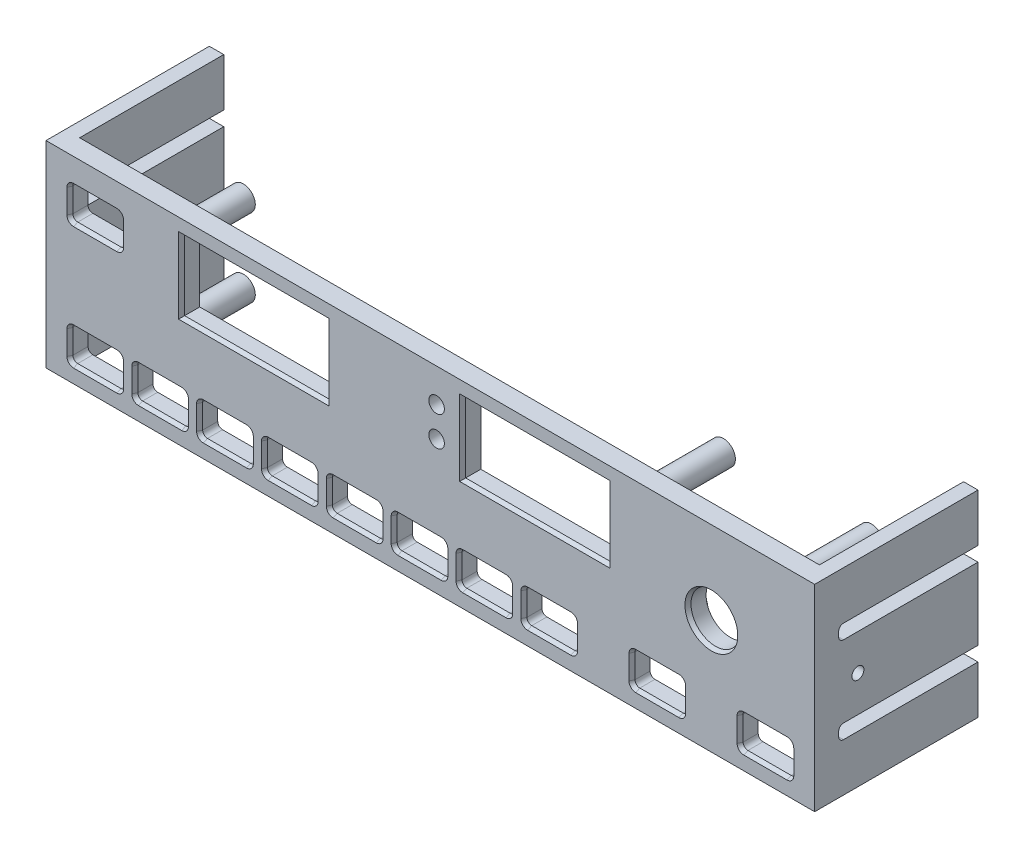
from build123d import *

# Parameters (mm, degrees)
ESQUISSE1_W             = 160
ESQUISSE1_H             = 41
BOSS_EXTRU_1_DEPTH      = 4
ESQUISSE2_R             = 5.1
ESQUISSE2_R_2           = 1.625
ESQUISSE2_W             = 30.5
ESQUISSE2_H             = 15
ENL_V_MAT_EXTRU_1_DEPTH = 4
ESQUISSE4_W             = 3
ESQUISSE4_H             = 41
BOSS_EXTRU_2_DEPTH      = 30
ENL_V_MAT_EXTRU_2_DEPTH = 168.871975029
ESQUISSE7_R             = 2.5
ESQUISSE7_R_2           = 1.25
BOSS_EXTRU_3_DEPTH      = 15
CHANFREIN1_SIZE         = 0.4
CHANFREIN1_SIZE2        = 0.857802768
ESQUISSE9_R             = 1.25
ENL_V_MAT_EXTRU_3_DEPTH = 900


with BuildPart() as part:
    # Esquisse1 → Boss.-Extru.1 (new body)
    with BuildSketch(Plane.XY):
        with Locations((80, 20.5)):
            Rectangle(ESQUISSE1_W, ESQUISSE1_H)
    extrude(amount=BOSS_EXTRU_1_DEPTH)

    # Esquisse2 → Enlèv. mat.-Extru.1 (cut)
    with BuildSketch(Plane.XY.offset(4)):
        with Locations((138.5, 23.75)):
            Circle(ESQUISSE2_R)
        with Locations((81.3, 34.05)):
            Circle(ESQUISSE2_R_2)
        with Locations((81.3, 27.83)):
            Circle(ESQUISSE2_R_2)
        with BuildLine():
            Line((19.25, 10.25), (28.25, 10.25))
            ThreePointArc((28.25, 10.25), (28.957106781, 9.957106781), (29.25, 9.25))
            Line((29.25, 9.25), (29.25, 4.25))
            ThreePointArc((29.25, 4.25), (28.957106781, 3.542893219), (28.25, 3.25))
            Line((28.25, 3.25), (19.25, 3.25))
            ThreePointArc((19.25, 3.25), (18.542893219, 3.542893219), (18.25, 4.25))
            Line((18.25, 4.25), (18.25, 9.25))
            ThreePointArc((18.25, 9.25), (18.542893219, 9.957106781), (19.25, 10.25))
        make_face()
        with BuildLine():
            Line((5.75, 3.25), (14.75, 3.25))
            ThreePointArc((14.75, 3.25), (15.457106781, 3.542893219), (15.75, 4.25))
            Line((15.75, 4.25), (15.75, 9.25))
            ThreePointArc((15.75, 9.25), (15.457106781, 9.957106781), (14.75, 10.25))
            Line((14.75, 10.25), (5.75, 10.25))
            ThreePointArc((5.75, 10.25), (5.042893219, 9.957106781), (4.75, 9.25))
            Line((4.75, 9.25), (4.75, 4.25))
            ThreePointArc((4.75, 4.25), (5.042893219, 3.542893219), (5.75, 3.25))
        make_face()
        with BuildLine():
            Line((32.75, 10.25), (41.75, 10.25))
            ThreePointArc((41.75, 10.25), (42.457106781, 9.957106781), (42.75, 9.25))
            Line((42.75, 9.25), (42.75, 4.25))
            ThreePointArc((42.75, 4.25), (42.457106781, 3.542893219), (41.75, 3.25))
            Line((41.75, 3.25), (32.75, 3.25))
            ThreePointArc((32.75, 3.25), (32.042893219, 3.542893219), (31.75, 4.25))
            Line((31.75, 4.25), (31.75, 9.25))
            ThreePointArc((31.75, 9.25), (32.042893219, 9.957106781), (32.75, 10.25))
        make_face()
        with BuildLine():
            Line((46.25, 10.25), (55.25, 10.25))
            ThreePointArc((55.25, 10.25), (55.957106781, 9.957106781), (56.25, 9.25))
            Line((56.25, 9.25), (56.25, 4.25))
            ThreePointArc((56.25, 4.25), (55.957106781, 3.542893219), (55.25, 3.25))
            Line((55.25, 3.25), (46.25, 3.25))
            ThreePointArc((46.25, 3.25), (45.542893219, 3.542893219), (45.25, 4.25))
            Line((45.25, 4.25), (45.25, 9.25))
            ThreePointArc((45.25, 9.25), (45.542893219, 9.957106781), (46.25, 10.25))
        make_face()
        with BuildLine():
            Line((59.75, 10.25), (68.75, 10.25))
            ThreePointArc((68.75, 10.25), (69.457106781, 9.957106781), (69.75, 9.25))
            Line((69.75, 9.25), (69.75, 4.25))
            ThreePointArc((69.75, 4.25), (69.457106781, 3.542893219), (68.75, 3.25))
            Line((68.75, 3.25), (59.75, 3.25))
            ThreePointArc((59.75, 3.25), (59.042893219, 3.542893219), (58.75, 4.25))
            Line((58.75, 4.25), (58.75, 9.25))
            ThreePointArc((58.75, 9.25), (59.042893219, 9.957106781), (59.75, 10.25))
        make_face()
        with BuildLine():
            Line((73.25, 10.25), (82.25, 10.25))
            ThreePointArc((82.25, 10.25), (82.957106781, 9.957106781), (83.25, 9.25))
            Line((83.25, 9.25), (83.25, 4.25))
            ThreePointArc((83.25, 4.25), (82.957106781, 3.542893219), (82.25, 3.25))
            Line((82.25, 3.25), (73.25, 3.25))
            ThreePointArc((73.25, 3.25), (72.542893219, 3.542893219), (72.25, 4.25))
            Line((72.25, 4.25), (72.25, 9.25))
            ThreePointArc((72.25, 9.25), (72.542893219, 9.957106781), (73.25, 10.25))
        make_face()
        with BuildLine():
            Line((86.75, 10.25), (95.75, 10.25))
            ThreePointArc((95.75, 10.25), (96.457106781, 9.957106781), (96.75, 9.25))
            Line((96.75, 9.25), (96.75, 4.25))
            ThreePointArc((96.75, 4.25), (96.457106781, 3.542893219), (95.75, 3.25))
            Line((95.75, 3.25), (86.75, 3.25))
            ThreePointArc((86.75, 3.25), (86.042893219, 3.542893219), (85.75, 4.25))
            Line((85.75, 4.25), (85.75, 9.25))
            ThreePointArc((85.75, 9.25), (86.042893219, 9.957106781), (86.75, 10.25))
        make_face()
        with BuildLine():
            Line((100.25, 10.25), (109.25, 10.25))
            ThreePointArc((109.25, 10.25), (109.957106781, 9.957106781), (110.25, 9.25))
            Line((110.25, 9.25), (110.25, 4.25))
            ThreePointArc((110.25, 4.25), (109.957106781, 3.542893219), (109.25, 3.25))
            Line((109.25, 3.25), (100.25, 3.25))
            ThreePointArc((100.25, 3.25), (99.542893219, 3.542893219), (99.25, 4.25))
            Line((99.25, 4.25), (99.25, 9.25))
            ThreePointArc((99.25, 9.25), (99.542893219, 9.957106781), (100.25, 10.25))
        make_face()
        with BuildLine():
            Line((122.75, 3.25), (131.75, 3.25))
            ThreePointArc((131.75, 3.25), (132.457106781, 3.542893219), (132.75, 4.25))
            Line((132.75, 4.25), (132.75, 9.25))
            ThreePointArc((132.75, 9.25), (132.457106781, 9.957106781), (131.75, 10.25))
            Line((131.75, 10.25), (122.75, 10.25))
            ThreePointArc((122.75, 10.25), (122.042893219, 9.957106781), (121.75, 9.25))
            Line((121.75, 9.25), (121.75, 4.25))
            ThreePointArc((121.75, 4.25), (122.042893219, 3.542893219), (122.75, 3.25))
        make_face()
        with BuildLine():
            Line((145.25, 3.25), (154.25, 3.25))
            ThreePointArc((154.25, 3.25), (154.957106781, 3.542893219), (155.25, 4.25))
            Line((155.25, 4.25), (155.25, 9.25))
            ThreePointArc((155.25, 9.25), (154.957106781, 9.957106781), (154.25, 10.25))
            Line((154.25, 10.25), (145.25, 10.25))
            ThreePointArc((145.25, 10.25), (144.542893219, 9.957106781), (144.25, 9.25))
            Line((144.25, 9.25), (144.25, 4.25))
            ThreePointArc((144.25, 4.25), (144.542893219, 3.542893219), (145.25, 3.25))
        make_face()
        with BuildLine():
            Line((5.75, 35.75), (14.75, 35.75))
            ThreePointArc((14.75, 35.75), (15.457106781, 35.457106781), (15.75, 34.75))
            Line((15.75, 34.75), (15.75, 29.75))
            ThreePointArc((15.75, 29.75), (15.457106781, 29.042893219), (14.75, 28.75))
            Line((14.75, 28.75), (5.75, 28.75))
            ThreePointArc((5.75, 28.75), (5.042893219, 29.042893219), (4.75, 29.75))
            Line((4.75, 29.75), (4.75, 34.75))
            ThreePointArc((4.75, 34.75), (5.042893219, 35.457106781), (5.75, 35.75))
        make_face()
        with Locations((43.25, 30.5)):
            Rectangle(ESQUISSE2_W, ESQUISSE2_H)
        with Locations((101.75, 30.5)):
            Rectangle(ESQUISSE2_W, ESQUISSE2_H)
    extrude(amount=-ENL_V_MAT_EXTRU_1_DEPTH, mode=Mode.SUBTRACT)

    # Esquisse4 → Boss.-Extru.2 (add)
    with BuildSketch(Plane(origin=(0, 0, 0), x_dir=(-1, 0, 0), z_dir=(0, 0, -1))):
        with Locations((-158.5, 20.5)):
            Rectangle(ESQUISSE4_W, ESQUISSE4_H)
        with Locations((-1.5, 20.5)):
            Rectangle(ESQUISSE4_W, ESQUISSE4_H)
    extrude(amount=BOSS_EXTRU_2_DEPTH)

    # Esquisse5 → Enlèv. mat.-Extru.2 (cut, through all)
    with BuildSketch(Plane(origin=(160, 0, 0), x_dir=(0, 0, -1), z_dir=(1, 0, 0))):
        with BuildLine():
            Line((30, 13), (2, 13))
            ThreePointArc((2, 13), (1.292893219, 12.707106781), (1, 12))
            Line((1, 12), (1, 11))
            ThreePointArc((1, 11), (1.292893219, 10.292893219), (2, 10))
            Line((2, 10), (30, 10))
            Line((30, 10), (30, 13))
        make_face()
        with BuildLine():
            Line((30, 31), (2, 31))
            ThreePointArc((2, 31), (1.292893219, 30.707106781), (1, 30))
            Line((1, 30), (1, 29))
            ThreePointArc((1, 29), (1.292893219, 28.292893219), (2, 28))
            Line((2, 28), (30, 28))
            Line((30, 28), (30, 31))
        make_face()
    extrude(amount=-ENL_V_MAT_EXTRU_2_DEPTH, mode=Mode.SUBTRACT)

    # Esquisse7 → Boss.-Extru.3 (add)
    # profile 1 of 7: a face of its own
    with BuildSketch(Plane(origin=(0, 0, 0), x_dir=(-1, 0, 0), z_dir=(0, 0, -1))):
        with Locations((-22.066417501, 32.220467417)):
            Circle(ESQUISSE7_R)
        with Locations((-22.066417501, 32.220467417)):
            Circle(ESQUISSE7_R_2, mode=Mode.SUBTRACT)
    # profile 2 of 7: a face of its own
    with BuildSketch(Plane(origin=(0, 0, 0), x_dir=(-1, 0, 0), z_dir=(0, 0, -1))):
        with Locations((-22.066417501, 15.960655172)):
            Circle(ESQUISSE7_R)
        with Locations((-22.066417501, 15.960655172)):
            Circle(ESQUISSE7_R_2, mode=Mode.SUBTRACT)
    # profile 3 of 7: a face of its own
    with BuildSketch(Plane(origin=(0, 0, 0), x_dir=(-1, 0, 0), z_dir=(0, 0, -1))):
        with Locations((-152.81245368, 36.297265299)):
            Circle(ESQUISSE7_R)
        with Locations((-152.81245368, 36.297265299)):
            Circle(ESQUISSE7_R_2, mode=Mode.SUBTRACT)
    # profile 4 of 7: a face of its own
    with BuildSketch(Plane(origin=(0, 0, 0), x_dir=(-1, 0, 0), z_dir=(0, 0, -1))):
        with Locations((-152.81245368, 14.495559759)):
            Circle(ESQUISSE7_R)
        with Locations((-152.81245368, 14.495559759)):
            Circle(ESQUISSE7_R_2, mode=Mode.SUBTRACT)
    # profile 5 of 7: a face of its own
    with BuildSketch(Plane(origin=(0, 0, 0), x_dir=(-1, 0, 0), z_dir=(0, 0, -1))):
        with Locations((-122, 36.297265299)):
            Circle(ESQUISSE7_R)
        with Locations((-122, 36.297265299)):
            Circle(ESQUISSE7_R_2, mode=Mode.SUBTRACT)
    # profile 6 of 7: a face of its own
    with BuildSketch(Plane(origin=(0, 0, 0), x_dir=(-1, 0, 0), z_dir=(0, 0, -1))):
        with Locations((-116.25, 6.75)):
            Circle(ESQUISSE7_R)
        with Locations((-116.25, 6.75)):
            Circle(ESQUISSE7_R_2, mode=Mode.SUBTRACT)
    # profile 7 of 7: a face of its own
    with BuildSketch(Plane(origin=(0, 0, 0), x_dir=(-1, 0, 0), z_dir=(0, 0, -1))):
        with Locations((-63.5, 14.495559759)):
            Circle(ESQUISSE7_R)
        with Locations((-63.5, 14.495559759)):
            Circle(ESQUISSE7_R_2, mode=Mode.SUBTRACT)
    extrude(amount=BOSS_EXTRU_3_DEPTH)

    # Chanfrein1
    chanfrein1_edges = [part.edges().sort_by_distance(p)[0] for p in [
        (101.75, 38, 4),
        (117, 30.5, 4),
        (101.75, 23, 4),
        (86.5, 30.5, 4),
        (58.5, 30.5, 4),
        (43.25, 23, 4),
        (28, 30.5, 4),
        (43.25, 38, 4),
        (133.4, 23.75, 4),
        (149.75, 3.25, 4),
        (154.957106781, 3.542893219, 4),
        (144.542893219, 3.542893219, 4),
        (155.25, 6.75, 4),
        (144.25, 6.75, 4),
        (154.957106781, 9.957106781, 4),
        (144.542893219, 9.957106781, 4),
        (149.75, 10.25, 4),
        (127.25, 3.25, 4),
        (132.457106781, 3.542893219, 4),
        (122.042893219, 3.542893219, 4),
        (132.75, 6.75, 4),
        (121.75, 6.75, 4),
        (132.457106781, 9.957106781, 4),
        (122.042893219, 9.957106781, 4),
        (127.25, 10.25, 4),
        (104.75, 3.25, 4),
        (109.957106781, 3.542893219, 4),
        (99.542893219, 3.542893219, 4),
        (110.25, 6.75, 4),
        (99.25, 6.75, 4),
        (109.957106781, 9.957106781, 4),
        (99.542893219, 9.957106781, 4),
        (104.75, 10.25, 4),
        (91.25, 3.25, 4),
        (96.457106781, 3.542893219, 4),
        (86.042893219, 3.542893219, 4),
        (96.75, 6.75, 4),
        (85.75, 6.75, 4),
        (96.457106781, 9.957106781, 4),
        (86.042893219, 9.957106781, 4),
        (91.25, 10.25, 4),
        (77.75, 3.25, 4),
        (82.957106781, 3.542893219, 4),
        (72.542893219, 3.542893219, 4),
        (83.25, 6.75, 4),
        (72.25, 6.75, 4),
        (82.957106781, 9.957106781, 4),
        (72.542893219, 9.957106781, 4),
        (77.75, 10.25, 4),
        (64.25, 3.25, 4),
        (69.457106781, 3.542893219, 4),
        (59.042893219, 3.542893219, 4),
        (69.75, 6.75, 4),
        (58.75, 6.75, 4),
        (69.457106781, 9.957106781, 4),
        (59.042893219, 9.957106781, 4),
        (64.25, 10.25, 4),
        (50.75, 3.25, 4),
        (55.957106781, 3.542893219, 4),
        (45.542893219, 3.542893219, 4),
        (56.25, 6.75, 4),
        (45.25, 6.75, 4),
        (55.957106781, 9.957106781, 4),
        (45.542893219, 9.957106781, 4),
        (50.75, 10.25, 4),
        (37.25, 3.25, 4),
        (42.457106781, 3.542893219, 4),
        (32.042893219, 3.542893219, 4),
        (42.75, 6.75, 4),
        (31.75, 6.75, 4),
        (42.457106781, 9.957106781, 4),
        (32.042893219, 9.957106781, 4),
        (37.25, 10.25, 4),
        (23.75, 3.25, 4),
        (28.957106781, 3.542893219, 4),
        (18.542893219, 3.542893219, 4),
        (29.25, 6.75, 4),
        (18.25, 6.75, 4),
        (28.957106781, 9.957106781, 4),
        (18.542893219, 9.957106781, 4),
        (23.75, 10.25, 4),
        (10.25, 3.25, 4),
        (15.457106781, 3.542893219, 4),
        (5.042893219, 3.542893219, 4),
        (15.75, 6.75, 4),
        (4.75, 6.75, 4),
        (15.457106781, 9.957106781, 4),
        (5.042893219, 9.957106781, 4),
        (10.25, 10.25, 4),
        (10.25, 35.75, 4),
        (5.042893219, 35.457106781, 4),
        (15.457106781, 35.457106781, 4),
        (4.75, 32.25, 4),
        (15.75, 32.25, 4),
        (5.042893219, 29.042893219, 4),
        (15.457106781, 29.042893219, 4),
        (10.25, 28.75, 4),
    ]]
    chanfrein1_side = [part.faces().sort_by_distance(p)[0] for p in [
        (82.584024265, 20.497031932, 4),
    ]]
    chamfer(chanfrein1_edges, length=CHANFREIN1_SIZE, length2=CHANFREIN1_SIZE2, reference=chanfrein1_side[0])

    # Esquisse9 → Enlèv. mat.-Extru.3 (cut)
    with BuildSketch(Plane(origin=(160, 0, 0), x_dir=(0, 0, -1), z_dir=(1, 0, 0))):
        with Locations((5, 20.5)):
            Circle(ESQUISSE9_R)
    extrude(amount=-ENL_V_MAT_EXTRU_3_DEPTH, mode=Mode.SUBTRACT)


solid = part.part
